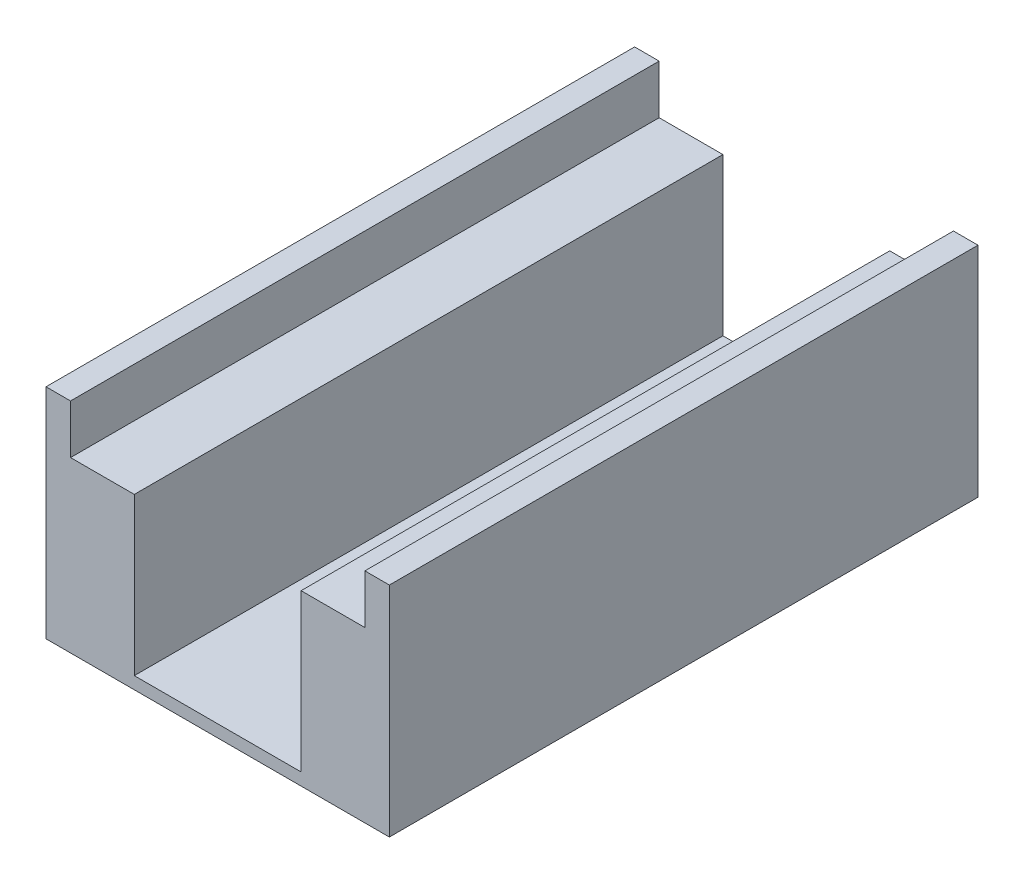
from build123d import *

# Parameters (mm, degrees)
SKETCH1_W           = 88.9
SKETCH1_H           = 152.4
BOSS_EXTRUDE1_DEPTH = 3.175
SKETCH2_W           = 22.86
SKETCH2_H           = 152.4
BOSS_EXTRUDE2_DEPTH = 40.64
SKETCH3_W           = 6.35
SKETCH3_H           = 152.4
BOSS_EXTRUDE3_DEPTH = 12.7


with BuildPart() as part:
    # Sketch1 → Boss-Extrude1 (new body)
    with BuildSketch(Plane(origin=(0, 0, 0), x_dir=(1, 0, 0), z_dir=(0, 1, 0))):
        Rectangle(SKETCH1_W, SKETCH1_H)
    extrude(amount=BOSS_EXTRUDE1_DEPTH)

    # Sketch2 → Boss-Extrude2 (add)
    with BuildSketch(Plane(origin=(0, 3.175, 0), x_dir=(1, 0, 0), z_dir=(0, 1, 0))):
        with Locations((-33.02, 0)):
            Rectangle(SKETCH2_W, SKETCH2_H)
        with Locations((33.02, 0)):
            Rectangle(SKETCH2_W, SKETCH2_H)
    extrude(amount=BOSS_EXTRUDE2_DEPTH)

    # Sketch3 → Boss-Extrude3 (add)
    with BuildSketch(Plane(origin=(0, 43.815, 0), x_dir=(1, 0, 0), z_dir=(0, 1, 0))):
        with Locations((-41.275, 0)):
            Rectangle(SKETCH3_W, SKETCH3_H)
        with Locations((41.275, 0)):
            Rectangle(SKETCH3_W, SKETCH3_H)
    extrude(amount=BOSS_EXTRUDE3_DEPTH)


solid = part.part
